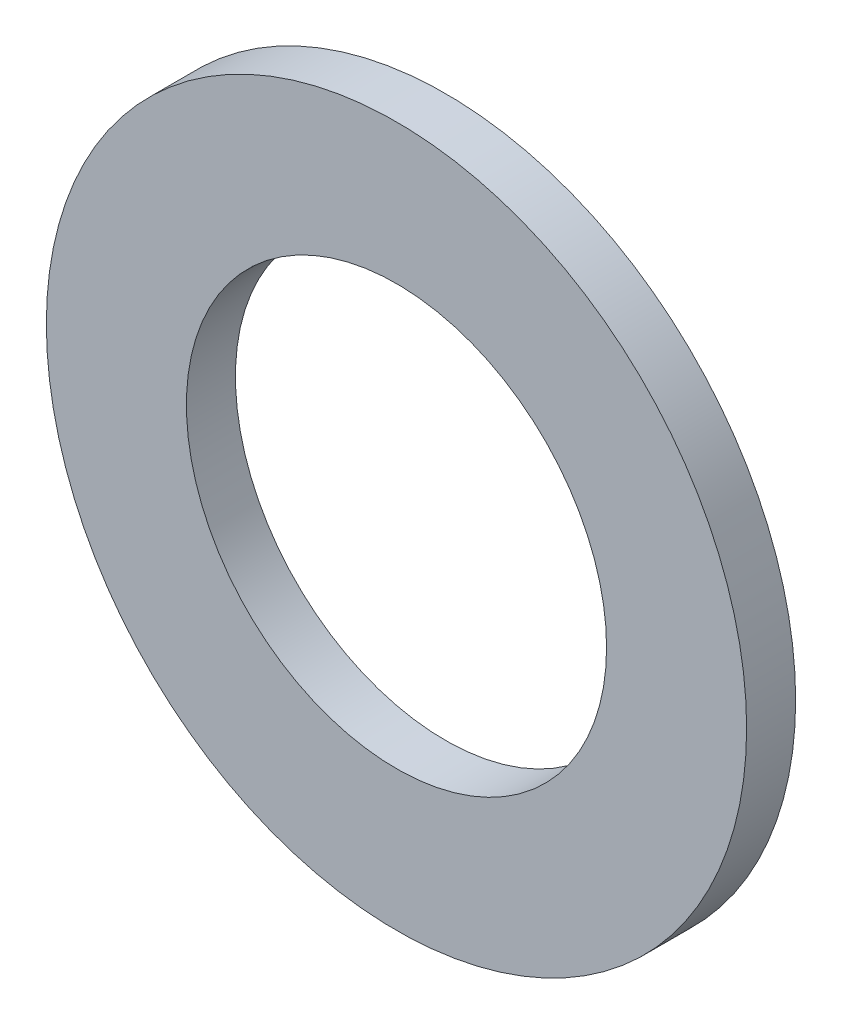
from build123d import *

# Parameters (mm, degrees)
SKETCH1_R           = 10
SKETCH1_R_2         = 6
BOSS_EXTRUDE1_DEPTH = 1.4


with BuildPart() as part:
    # Sketch1 → Boss-Extrude1 (new body)
    with BuildSketch(Plane.XY):
        Circle(SKETCH1_R)
        Circle(SKETCH1_R_2, mode=Mode.SUBTRACT)
    extrude(amount=BOSS_EXTRUDE1_DEPTH)


solid = part.part
